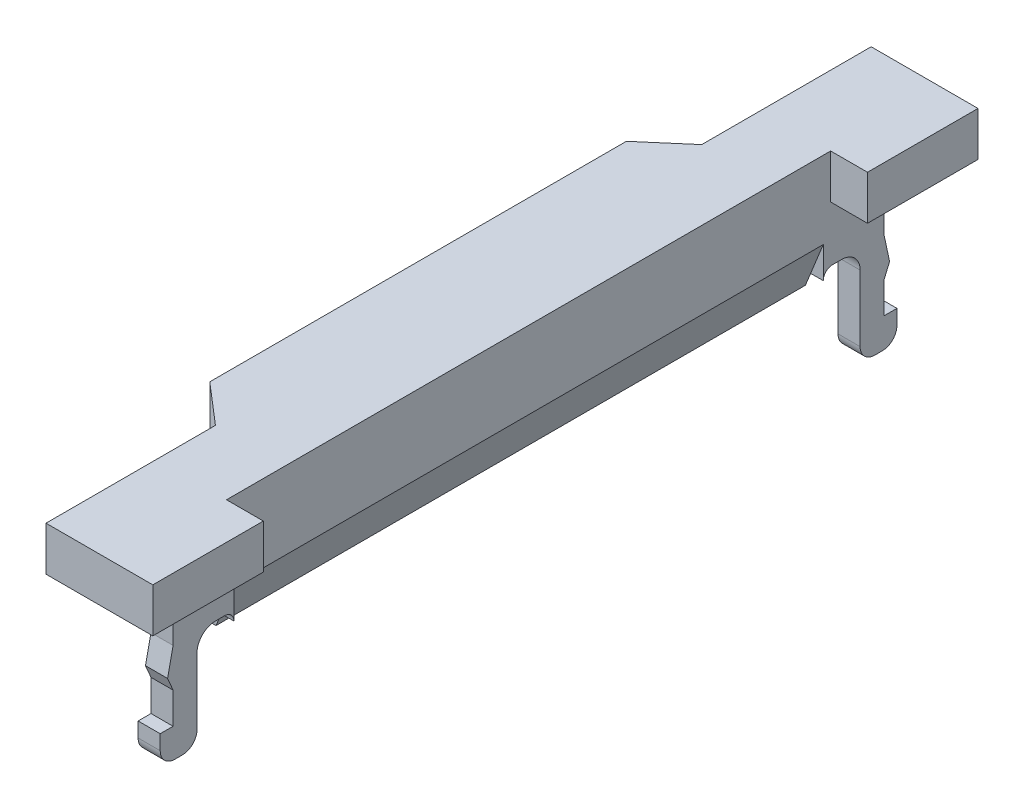
from build123d import *

# Parameters (mm, degrees)
RESSALTO_EXTRUS_O1_DEPTH = 1.2
ESBO_O2_W                = 0.6
ESBO_O2_H                = 16
RESSALTO_EXTRUS_O2_DEPTH = 2.1
CHANFRO1_SIZE            = 1.2
CHANFRO1_SIZE2           = 0.484831471
RESSALTO_EXTRUS_O3_REACH = 13.645


with BuildPart() as part:
    # Esboço1 → Ressalto-extrusão1 (new body)
    with BuildSketch(Plane(origin=(0, 0, 0), x_dir=(1, 0, 0), z_dir=(0, 1, 0))):
        Polygon((2, 8.2), (2, 11.2), (-0.9, 11.2), (-0.9, 6.6), (-2, 5.654746766), (-2, -5.654746766), (-0.9, -6.6), (-0.9, -11.2), (2, -11.2), (2, -8.2), (1, -8.2), (1, 8.2), align=None)
    extrude(amount=RESSALTO_EXTRUS_O1_DEPTH)

    # Esboço2 → Ressalto-extrusão2 (add)
    with BuildSketch(Plane.XZ):
        with Locations((0.7, 0)):
            Rectangle(ESBO_O2_W, ESBO_O2_H)
    extrude(amount=RESSALTO_EXTRUS_O2_DEPTH)

    # Chanfro1
    chanfro1_edges = [part.edges().sort_by_distance(p)[0] for p in [
        (1, -2.1, 0),
    ]]
    chanfro1_side = [part.faces().sort_by_distance(p)[0] for p in [
        (1, -0.440540541, 0),
    ]]
    chamfer(chanfro1_edges, length=CHANFRO1_SIZE, length2=CHANFRO1_SIZE2, reference=chanfro1_side[0])

    # Ressalto-extrusão3: up to this face of the body (flat: up to its plane)
    ressalto_extrus_o3_end = Plane(part.part.faces().sort_by_distance((1, 0.156338028, 0))[0])
    # Esboço3 → Ressalto-extrusão3 (add, up to the picked face)
    with BuildSketch(Plane.ZY.offset(-0.4), mode=Mode.PRIVATE) as ressalto_extrus_o3_sk1:
        with BuildLine():
            Line((-8.25, -1.5), (-8.5, -1.5))
            ThreePointArc((-8.5, -1.5), (-8.853553391, -1.646446609), (-9, -2))
            Line((-9, -2), (-9, -3.8))
            ThreePointArc((-9, -3.8), (-9.117157288, -4.082842712), (-9.4, -4.2))
            Line((-9.4, -4.2), (-9.6, -4.2))
            ThreePointArc((-9.6, -4.2), (-9.882842712, -4.082842712), (-10, -3.8))
            Line((-10, -3.8), (-10, -3.4))
            Line((-10, -3.4), (-9.65, -3.4))
            Line((-9.65, -3.4), (-9.65, -2.55))
            Line((-9.65, -2.55), (-9.8, -2.2))
            Line((-9.8, -2.2), (-9.65, -1.5))
            Line((-9.65, -1.5), (-9.65, -0.7))
            Line((-9.65, -0.7), (-9.85, -0.5))
            Line((-9.85, -0.5), (-9.85, -0.3))
            Line((-9.85, -0.3), (-9.65, 0))
            Line((-9.65, 0), (-8, 0))
            Line((-8, 0), (-8, -1.75))
            ThreePointArc((-8, -1.75), (-8.073223305, -1.573223305), (-8.25, -1.5))
        make_face()
    ressalto_extrus_o3_tool1 = split(extrude(ressalto_extrus_o3_sk1.sketch, amount=-RESSALTO_EXTRUS_O3_REACH, mode=Mode.PRIVATE), bisect_by=ressalto_extrus_o3_end, keep=Keep.BOTH, mode=Mode.PRIVATE)
    ressalto_extrus_o3 = ressalto_extrus_o3_tool1.solids().sort_by(Axis((0.4, -1.698568, -9.093266), (1, 0, 0)))[0]
    add(ressalto_extrus_o3)

    # Espelhar1: Ressalto-extrusão3 across plane
    add(ressalto_extrus_o3.mirror(Plane.XY))


solid = part.part
